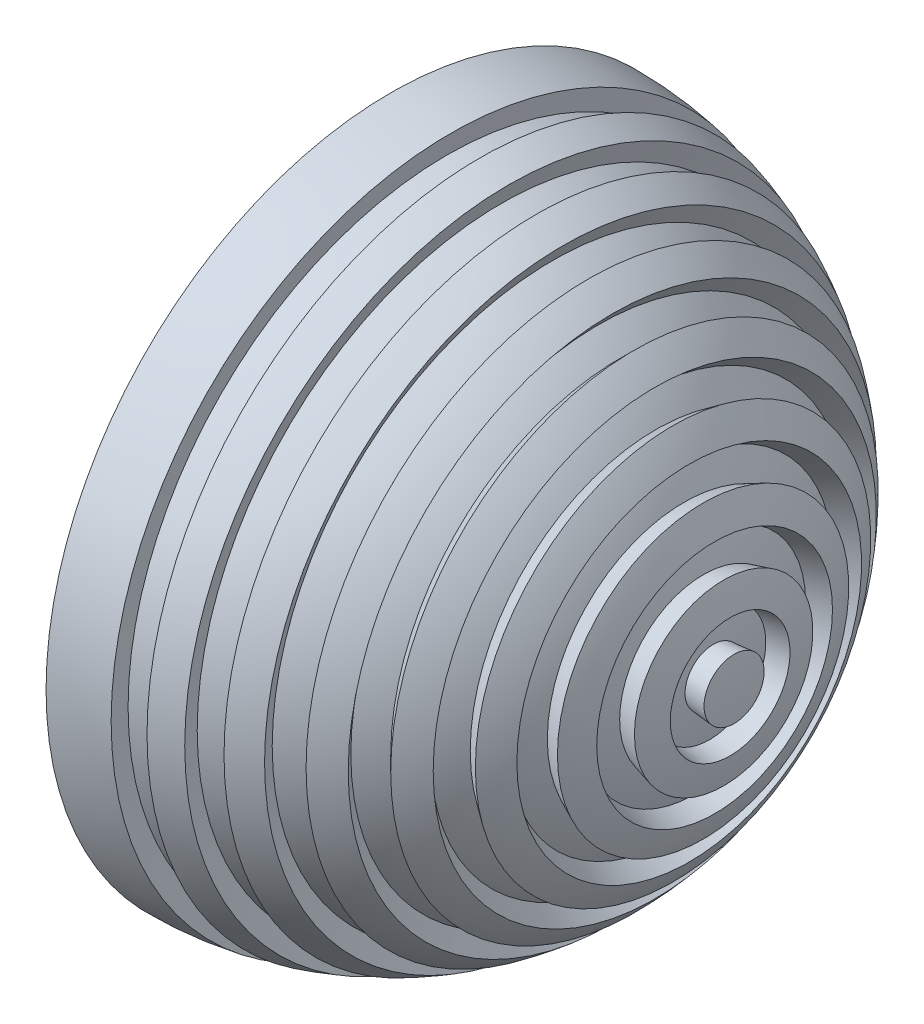
from build123d import *


with BuildPart() as part:
    # 草图1 → 旋转2 (revolve)
    with BuildSketch(Plane(origin=(0, 0, 0), x_dir=(1, 0, 0), z_dir=(0, 1, 0))):
        with BuildLine():
            Line((0, 0), (16.5, 0))
            ThreePointArc((16.5, 0), (16.484295656, -0.719719892), (16.437212519, -1.438069755))
            Line((16.437212519, -1.438069755), (15.44101782, -1.350914013))
            ThreePointArc((15.44101782, -1.350914013), (15.367395351, -2.023155979), (15.264520172, -2.691546754))
            Line((15.264520172, -2.691546754), (16.249327925, -2.865194932))
            ThreePointArc((16.249327925, -2.865194932), (16.108884117, -3.57125363), (15.937776134, -4.270514244))
            Line((15.937776134, -4.270514244), (14.971850307, -4.011695199))
            ThreePointArc((14.971850307, -4.011695199), (14.782612737, -4.660939892), (14.565235622, -5.301312222))
            Line((14.565235622, -5.301312222), (15.504928243, -5.643332365))
            ThreePointArc((15.504928243, -5.643332365), (15.244012286, -6.314276634), (14.954078486, -6.973201319))
            Line((14.954078486, -6.973201319), (14.047770699, -6.550583057))
            ThreePointArc((14.047770699, -6.550583057), (13.748667914, -7.157103505), (13.423393759, -7.75))
            Line((13.423393759, -7.75), (14.289419162, -8.25))
            ThreePointArc((14.289419162, -8.25), (13.915958856, -8.865443538), (13.516008731, -9.4640112))
            Line((13.516008731, -9.4640112), (12.696856686, -8.890434763))
            ThreePointArc((12.696856686, -8.890434763), (12.296976775, -9.43580215), (11.873688868, -9.96320795))
            Line((11.873688868, -9.96320795), (12.639733311, -10.60599556))
            ThreePointArc((12.639733311, -10.60599556), (12.165076057, -11.147238426), (11.66726189, -11.66726189))
            Line((11.66726189, -11.66726189), (10.960155108, -10.960155108))
            ThreePointArc((10.960155108, -10.960155108), (10.471648218, -11.427798721), (9.96320795, -11.873688868))
            Line((9.96320795, -11.873688868), (10.60599556, -12.639733311))
            ThreePointArc((10.60599556, -12.639733311), (10.044563579, -13.090330115), (9.4640112, -13.516008731))
            Line((9.4640112, -13.516008731), (8.890434763, -12.696856686))
            ThreePointArc((8.890434763, -12.696856686), (8.328143929, -13.07256741), (7.75, -13.423393759))
            Line((7.75, -13.423393759), (8.25, -14.289419162))
            ThreePointArc((8.25, -14.289419162), (7.618852118, -14.635678747), (6.973201319, -14.954078486))
            Line((6.973201319, -14.954078486), (6.550583057, -14.047770699))
            ThreePointArc((6.550583057, -14.047770699), (5.931593202, -14.320132754), (5.301312222, -14.565235622))
            Line((5.301312222, -14.565235622), (5.643332365, -15.504928243))
            ThreePointArc((5.643332365, -15.504928243), (4.961645692, -15.736329687), (4.270514244, -15.937776134))
            Line((4.270514244, -15.937776134), (4.011695199, -14.971850307))
            ThreePointArc((4.011695199, -14.971850307), (3.354814016, -15.13258811), (2.691546754, -15.264520172))
            Line((2.691546754, -15.264520172), (2.865194932, -16.249327925))
            ThreePointArc((2.865194932, -16.249327925), (2.153682172, -16.358840213), (1.438069755, -16.437212519))
            ThreePointArc((1.438069755, -16.437212519), (0.719719892, -16.484295656), (0, -16.5))
            Line((0, -16.5), (0, -15.5))
            Line((0, -15.5), (0.931821747, -15.231286006))
            Line((0.931821747, -15.231286006), (0, -12))
            Line((0, -12), (0, 0))
        make_face()
    revolve(axis=Axis((0, 0, 0), (1, 0, 0)))


solid = part.part
